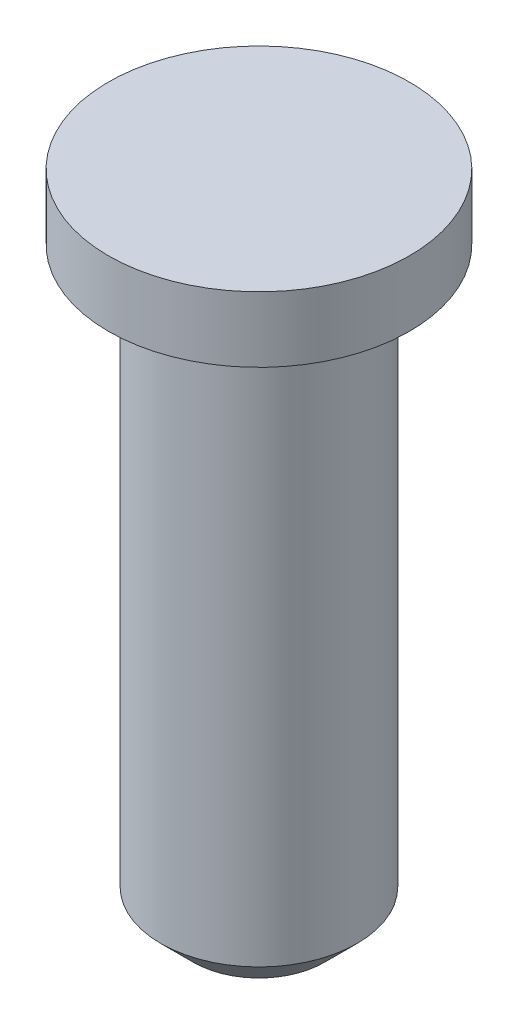
from build123d import *

# Parameters (mm, degrees)
CHAFL_N1_SIZE = 0.5


with BuildPart() as part:
    # Croquis1 → Revolución1 (revolve)
    with BuildSketch(Plane.XY, mode=Mode.PRIVATE) as revoluci_n1_sk:
        Polygon((0, 0), (2.3, 0), (2.3, -1), (1.5, -1), (1.5, -10), (0, -10), align=None)
    revolve(revoluci_n1_sk.sketch.rotate(Axis((0, 0, 0), (0, -1, 0)), 90), axis=Axis((0, 0, 0), (0, -1, 0)))

    # Chaflán1
    chafl_n1_edges = [part.edges().sort_by_distance(p)[0] for p in [
        (0, -10, -1.5),
    ]]
    chamfer(chafl_n1_edges, length=CHAFL_N1_SIZE)


solid = part.part
